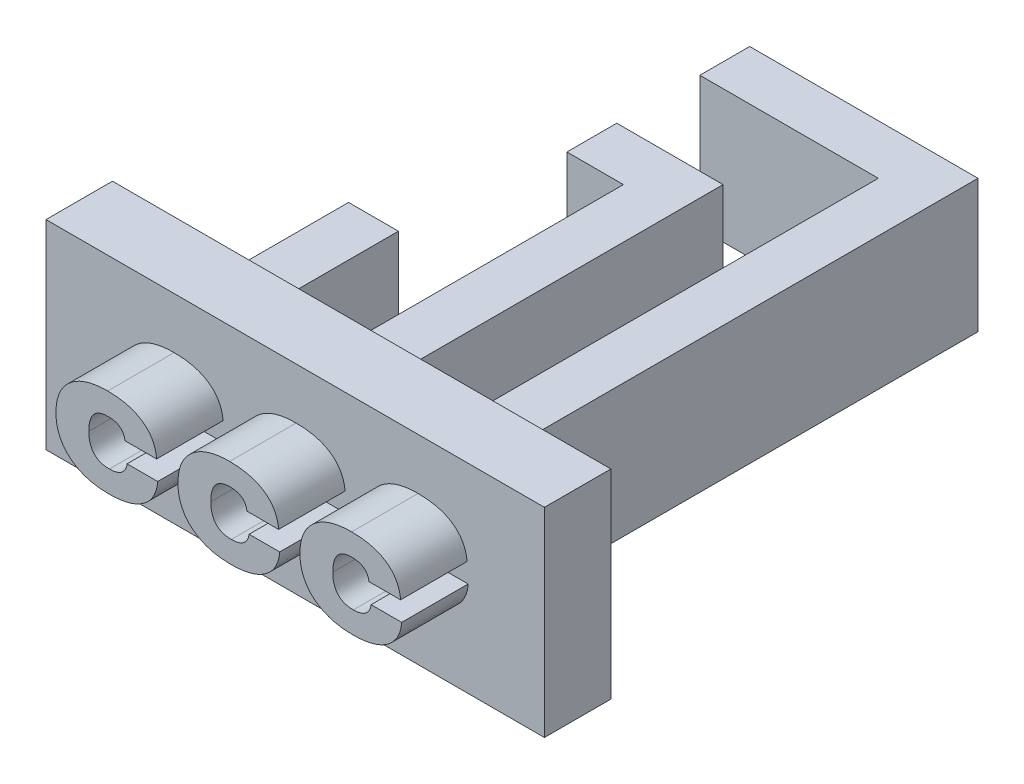
from build123d import *

# Parameters (mm, degrees)
SKETCH1_W           = 15
SKETCH1_H           = 6
BOSS_EXTRUDE1_DEPTH = 2
BOSS_EXTRUDE2_DEPTH = 2
SKETCH3_W           = 1.5
SKETCH3_H           = 4
BOSS_EXTRUDE3_DEPTH = 2


with BuildPart() as part:
    # Sketch1 → Boss-Extrude1 (new body)
    with BuildSketch(Plane.XY):
        Rectangle(SKETCH1_W, SKETCH1_H)
    extrude(amount=BOSS_EXTRUDE1_DEPTH)

    # Sketch2 → Boss-Extrude2 (add)
    with BuildSketch(Plane.XY.offset(2)):
        with BuildLine():
            Line((-3.060082731, -0.145888163), (-2.138122178, -0.145888163))
            add(Edge.make_bspline(
                [(-2.138122178, -0.145888163), (-2.142670856, -0.186817863), (-2.151591905, -0.267090827), (-2.177769169, -0.383345409), (-2.21581097, -0.492138159), (-2.263624462, -0.594453887), (-2.323094811, -0.689286262), (-2.393268208, -0.777226894), (-2.474496925, -0.857513187), (-2.56593251, -0.930702134), (-2.666921735, -0.996049335), (-2.776982197, -1.052595512), (-2.895454873, -1.100578301), (-3.022533127, -1.139544776), (-3.158112272, -1.169766838), (-3.302219404, -1.190920315), (-3.454592079, -1.204838445), (-3.559102892, -1.206109201), (-3.612641679, -1.206760184)],
                knots=[0, 0, 0, 0, 0.976829506, 1.915797078, 2.820653329, 3.707285315, 4.590388637, 5.470720937, 6.371504049, 7.295059075, 8.245589783, 9.221265507, 10.22720936, 11.275107911, 12.372107559, 13.52041678, 14.729759393, 16, 16, 16, 16], degree=3))
            add(Edge.make_bspline(
                [(-3.612641679, -1.206760184), (-3.672703037, -1.205681875), (-3.78980194, -1.203579545), (-3.960409691, -1.187028741), (-4.121131552, -1.159524222), (-4.272151379, -1.120467746), (-4.41338954, -1.070117311), (-4.545018014, -1.008999239), (-4.666052683, -0.9357143), (-4.759428604, -0.866298777), (-4.827861299, -0.80519677), (-4.876126049, -0.757629416), (-4.920907868, -0.707879294), (-4.961799812, -0.655502017), (-5.001017469, -0.602324328), (-5.03520084, -0.545835782), (-5.066531819, -0.487757573), (-5.095227297, -0.427867871), (-5.119706435, -0.365492075), (-5.141169611, -0.301230601), (-5.160246588, -0.235142926), (-5.173972983, -0.16652574), (-5.186283094, -0.096102513), (-5.194098935, -0.023574116), (-5.199662301, 0.050901618), (-5.200117214, 0.101226019), (-5.200348302, 0.126789902)],
                knots=[0, 0, 0, 0, 1.844349952, 3.595845402, 5.258382034, 6.847576437, 8.380255859, 9.857610627, 11.296535068, 12.718617156, 13.423703043, 14.112710587, 14.79899505, 15.477617194, 16.152961149, 16.826845299, 17.503194887, 18.179359879, 18.864977055, 19.559518563, 20.259847437, 20.975709944, 21.707382985, 22.454791923, 23.215062313, 24, 24, 24, 24], degree=3))
            add(Edge.make_bspline(
                [(-5.200348302, 0.126789902), (-5.20010237, 0.152180931), (-5.199614969, 0.202502272), (-5.194209089, 0.276824794), (-5.186092921, 0.349110093), (-5.174639319, 0.419303704), (-5.16060764, 0.487612395), (-5.142177766, 0.553751295), (-5.121526835, 0.618038985), (-5.096362936, 0.679989613), (-5.06892589, 0.74011142), (-5.037645758, 0.797974151), (-5.003916141, 0.854253903), (-4.966122932, 0.908133198), (-4.925686325, 0.960385835), (-4.880950125, 1.009688803), (-4.833769122, 1.057627908), (-4.766340776, 1.11879755), (-4.675008641, 1.189066666), (-4.555365546, 1.261581715), (-4.426723513, 1.323905616), (-4.288155058, 1.373282632), (-4.140527998, 1.412584115), (-3.983451282, 1.440688501), (-3.816730635, 1.457118665), (-3.702542629, 1.459248516), (-3.644025381, 1.460339989)],
                knots=[0, 0, 0, 0, 0.788949478, 1.563583616, 2.314590912, 3.048845008, 3.773225905, 4.480463959, 5.181590848, 5.870415235, 6.557195353, 7.234374924, 7.913502193, 8.595071886, 9.278472863, 9.965397725, 10.662604099, 11.368153272, 12.793402362, 14.235777976, 15.708930775, 17.227954371, 18.799982801, 20.451742852, 22.181645754, 24, 24, 24, 24], degree=3))
            add(Edge.make_bspline(
                [(-3.644025381, 1.460339989), (-3.590145407, 1.459654041), (-3.484967955, 1.458315025), (-3.331779518, 1.444898309), (-3.187282445, 1.425014513), (-3.051742807, 1.395613017), (-2.925065251, 1.357757509), (-2.807100237, 1.311399315), (-2.697988088, 1.256802381), (-2.597921972, 1.19407992), (-2.507288128, 1.123496152), (-2.42730916, 1.045048752), (-2.357479614, 0.959432927), (-2.298872924, 0.866301097), (-2.249803372, 0.766268305), (-2.212782576, 0.658660702), (-2.184664141, 0.544165897), (-2.175657871, 0.464783504), (-2.17104934, 0.42416334)],
                knots=[0, 0, 0, 0, 1.289638031, 2.517463008, 3.678757242, 4.779638757, 5.834372698, 6.840786757, 7.810284887, 8.751219913, 9.663723068, 10.555058948, 11.427779484, 12.302574037, 13.183982208, 14.089056298, 15.022165429, 16, 16, 16, 16], degree=3))
            Line((-2.17104934, 0.42416334), (-3.125937056, 0.42416334))
            add(Edge.make_bspline(
                [(-3.125937056, 0.42416334), (-3.127887549, 0.43930189), (-3.131710048, 0.468969842), (-3.142040136, 0.511730167), (-3.155998966, 0.551467781), (-3.173017188, 0.588472211), (-3.193630284, 0.622418347), (-3.217560825, 0.653683148), (-3.244880123, 0.682137249), (-3.275932903, 0.70732909), (-3.310313405, 0.72961548), (-3.347848304, 0.749134153), (-3.388701646, 0.76557697), (-3.432765481, 0.77899212), (-3.480105092, 0.789183756), (-3.530681368, 0.796119849), (-3.584421185, 0.801027394), (-3.621376024, 0.801535064), (-3.640423973, 0.801796736)],
                knots=[0, 0, 0, 0, 1.02792653, 2.014490992, 2.957386111, 3.862121815, 4.753924626, 5.627574869, 6.51019678, 7.405362218, 8.315615775, 9.266619089, 10.251558014, 11.278704828, 12.366648388, 13.51059177, 14.716862994, 16, 16, 16, 16], degree=3))
            add(Edge.make_bspline(
                [(-3.640423973, 0.801796736), (-3.66359615, 0.801322385), (-3.708533487, 0.800402487), (-3.773695909, 0.792761593), (-3.834173486, 0.779391176), (-3.890254475, 0.760839723), (-3.942034126, 0.737056913), (-3.989624331, 0.708404931), (-4.032399456, 0.67383737), (-4.070628025, 0.634091204), (-4.104105801, 0.588767942), (-4.133882485, 0.538692432), (-4.157647598, 0.482571167), (-4.177808251, 0.421494548), (-4.193663959, 0.355071069), (-4.204784234, 0.283334137), (-4.211575895, 0.206324597), (-4.212207123, 0.153214936), (-4.212533423, 0.125760928)],
                knots=[0, 0, 0, 0, 1.096253294, 2.125941888, 3.09853747, 4.02234602, 4.9155674, 5.789561441, 6.643741359, 7.510358195, 8.391630331, 9.304611926, 10.260406741, 11.268901007, 12.345516153, 13.487518248, 14.70122137, 16, 16, 16, 16], degree=3))
            add(Edge.make_bspline(
                [(-4.212533423, 0.125760928), (-4.212023732, 0.098820004), (-4.211034896, 0.046552836), (-4.20387538, -0.029304282), (-4.191745473, -0.100083864), (-4.174082766, -0.165772241), (-4.152269564, -0.226559049), (-4.125261299, -0.282308092), (-4.09338658, -0.333065066), (-4.056054059, -0.378504224), (-4.014296197, -0.419012114), (-3.96742428, -0.453622328), (-3.91626571, -0.483220184), (-3.860158566, -0.506780196), (-3.799647084, -0.525328362), (-3.73468148, -0.538434558), (-3.665177261, -0.547030055), (-3.617299342, -0.547812765), (-3.592576689, -0.548216932)],
                knots=[0, 0, 0, 0, 1.234472244, 2.394957414, 3.488022233, 4.52125041, 5.508253929, 6.443198368, 7.354559284, 8.248126489, 9.131859273, 10.013633023, 10.911406571, 11.833948595, 12.795981492, 13.807064445, 14.867636965, 16, 16, 16, 16], degree=3))
            add(Edge.make_bspline(
                [(-3.592576689, -0.548216932), (-3.573523043, -0.548008488), (-3.53637073, -0.547602048), (-3.482331036, -0.541902553), (-3.431051927, -0.534930223), (-3.383278569, -0.522562968), (-3.338007293, -0.508440572), (-3.295951089, -0.490511601), (-3.256998066, -0.469088819), (-3.220875063, -0.445176153), (-3.188314834, -0.417525473), (-3.158686185, -0.387396389), (-3.133666577, -0.353410241), (-3.111160748, -0.317572759), (-3.093383205, -0.278451413), (-3.078216775, -0.23709906), (-3.066824033, -0.192623437), (-3.06236613, -0.161718235), (-3.060082731, -0.145888163)],
                knots=[0, 0, 0, 0, 1.233312579, 2.404810797, 3.516940584, 4.580999436, 5.596108869, 6.586365755, 7.535726907, 8.472201243, 9.38661427, 10.29778373, 11.201885539, 12.11434029, 13.033597211, 13.978725792, 14.964675429, 16, 16, 16, 16], degree=3))
        make_face()
        with BuildLine():
            Line((0.611295902, -0.145888163), (1.533256455, -0.145888163))
            add(Edge.make_bspline(
                [(1.533256455, -0.145888163), (1.528707777, -0.186817863), (1.519786728, -0.267090827), (1.493609464, -0.383345409), (1.455567663, -0.492138159), (1.407754171, -0.594453887), (1.348283822, -0.689286262), (1.278110424, -0.777226894), (1.196881708, -0.857513187), (1.105446123, -0.930702134), (1.004456897, -0.996049335), (0.894396436, -1.052595512), (0.775923759, -1.100578301), (0.648845506, -1.139544776), (0.51326636, -1.169766838), (0.369159229, -1.190920315), (0.216786554, -1.204838445), (0.112275741, -1.206109201), (0.058736954, -1.206760184)],
                knots=[0, 0, 0, 0, 0.976829506, 1.915797078, 2.820653329, 3.707285315, 4.590388637, 5.470720937, 6.371504049, 7.295059075, 8.245589783, 9.221265507, 10.22720936, 11.275107911, 12.372107559, 13.52041678, 14.729759393, 16, 16, 16, 16], degree=3))
            add(Edge.make_bspline(
                [(0.058736954, -1.206760184), (-0.001324404, -1.205681875), (-0.118423307, -1.203579545), (-0.289031058, -1.187028741), (-0.449752919, -1.159524222), (-0.600772746, -1.120467746), (-0.742010907, -1.070117311), (-0.873639381, -1.008999239), (-0.99467405, -0.9357143), (-1.088049971, -0.866298777), (-1.156482666, -0.80519677), (-1.204747416, -0.757629416), (-1.249529235, -0.707879294), (-1.290421179, -0.655502017), (-1.329638836, -0.602324328), (-1.363822207, -0.545835782), (-1.395153186, -0.487757573), (-1.423848664, -0.427867871), (-1.448327802, -0.365492075), (-1.469790978, -0.301230601), (-1.488867955, -0.235142926), (-1.50259435, -0.16652574), (-1.514904461, -0.096102513), (-1.522720303, -0.023574116), (-1.528283668, 0.050901618), (-1.528738581, 0.101226019), (-1.528969669, 0.126789902)],
                knots=[0, 0, 0, 0, 1.844349952, 3.595845402, 5.258382034, 6.847576437, 8.380255859, 9.857610627, 11.296535068, 12.718617156, 13.423703043, 14.112710587, 14.79899505, 15.477617194, 16.152961149, 16.826845299, 17.503194887, 18.179359879, 18.864977055, 19.559518563, 20.259847437, 20.975709944, 21.707382985, 22.454791923, 23.215062313, 24, 24, 24, 24], degree=3))
            add(Edge.make_bspline(
                [(-1.528969669, 0.126789902), (-1.528723737, 0.152180931), (-1.528236336, 0.202502272), (-1.522830456, 0.276824794), (-1.514714289, 0.349110093), (-1.503260687, 0.419303704), (-1.489229007, 0.487612395), (-1.470799133, 0.553751295), (-1.450148202, 0.618038985), (-1.424984304, 0.679989613), (-1.397547257, 0.74011142), (-1.366267126, 0.797974151), (-1.332537508, 0.854253903), (-1.294744299, 0.908133198), (-1.254307692, 0.960385835), (-1.209571492, 1.009688803), (-1.162390489, 1.057627908), (-1.094962143, 1.11879755), (-1.003630008, 1.189066666), (-0.883986913, 1.261581715), (-0.75534488, 1.323905616), (-0.616776425, 1.373282632), (-0.469149365, 1.412584115), (-0.312072649, 1.440688501), (-0.145352002, 1.457118665), (-0.031163997, 1.459248516), (0.027353252, 1.460339989)],
                knots=[0, 0, 0, 0, 0.788949478, 1.563583616, 2.314590912, 3.048845008, 3.773225905, 4.480463959, 5.181590848, 5.870415235, 6.557195353, 7.234374924, 7.913502193, 8.595071886, 9.278472863, 9.965397725, 10.662604099, 11.368153272, 12.793402362, 14.235777976, 15.708930775, 17.227954371, 18.799982801, 20.451742852, 22.181645754, 24, 24, 24, 24], degree=3))
            add(Edge.make_bspline(
                [(0.027353252, 1.460339989), (0.081233226, 1.459654041), (0.186410678, 1.458315025), (0.339599115, 1.444898309), (0.484096188, 1.425014513), (0.619635826, 1.395613017), (0.746313382, 1.357757509), (0.864278396, 1.311399315), (0.973390545, 1.256802381), (1.073456661, 1.19407992), (1.164090505, 1.123496152), (1.244069473, 1.045048752), (1.313899019, 0.959432927), (1.372505709, 0.866301097), (1.421575261, 0.766268305), (1.458596057, 0.658660702), (1.486714492, 0.544165897), (1.495720762, 0.464783504), (1.500329293, 0.42416334)],
                knots=[0, 0, 0, 0, 1.289638031, 2.517463008, 3.678757242, 4.779638757, 5.834372698, 6.840786757, 7.810284887, 8.751219913, 9.663723068, 10.555058948, 11.427779484, 12.302574037, 13.183982208, 14.089056298, 15.022165429, 16, 16, 16, 16], degree=3))
            Line((1.500329293, 0.42416334), (0.545441576, 0.42416334))
            add(Edge.make_bspline(
                [(0.545441576, 0.42416334), (0.543491084, 0.43930189), (0.539668585, 0.468969842), (0.529338497, 0.511730167), (0.515379666, 0.551467781), (0.498361445, 0.588472211), (0.477748349, 0.622418347), (0.453817808, 0.653683148), (0.42649851, 0.682137249), (0.39544573, 0.70732909), (0.361065228, 0.72961548), (0.323530328, 0.749134153), (0.282676987, 0.76557697), (0.238613151, 0.77899212), (0.191273541, 0.789183756), (0.140697265, 0.796119849), (0.086957447, 0.801027394), (0.050002609, 0.801535064), (0.03095466, 0.801796736)],
                knots=[0, 0, 0, 0, 1.02792653, 2.014490992, 2.957386111, 3.862121815, 4.753924626, 5.627574869, 6.51019678, 7.405362218, 8.315615775, 9.266619089, 10.251558014, 11.278704828, 12.366648388, 13.51059177, 14.716862994, 16, 16, 16, 16], degree=3))
            add(Edge.make_bspline(
                [(0.03095466, 0.801796736), (0.007782483, 0.801322385), (-0.037154854, 0.800402487), (-0.102317276, 0.792761593), (-0.162794853, 0.779391176), (-0.218875842, 0.760839723), (-0.270655493, 0.737056913), (-0.318245698, 0.708404931), (-0.361020823, 0.67383737), (-0.399249392, 0.634091204), (-0.432727168, 0.588767942), (-0.462503853, 0.538692432), (-0.486268965, 0.482571167), (-0.506429618, 0.421494548), (-0.522285326, 0.355071069), (-0.533405601, 0.283334137), (-0.540197262, 0.206324597), (-0.54082849, 0.153214936), (-0.54115479, 0.125760928)],
                knots=[0, 0, 0, 0, 1.096253294, 2.125941888, 3.09853747, 4.02234602, 4.9155674, 5.789561441, 6.643741359, 7.510358195, 8.391630331, 9.304611926, 10.260406741, 11.268901007, 12.345516153, 13.487518248, 14.70122137, 16, 16, 16, 16], degree=3))
            add(Edge.make_bspline(
                [(-0.54115479, 0.125760928), (-0.540645099, 0.098820004), (-0.539656263, 0.046552836), (-0.532496747, -0.029304282), (-0.52036684, -0.100083864), (-0.502704133, -0.165772241), (-0.480890931, -0.226559049), (-0.453882667, -0.282308092), (-0.422007947, -0.333065066), (-0.384675426, -0.378504224), (-0.342917564, -0.419012114), (-0.296045647, -0.453622328), (-0.244887077, -0.483220184), (-0.188779933, -0.506780196), (-0.128268451, -0.525328362), (-0.063302847, -0.538434558), (0.006201372, -0.547030055), (0.054079291, -0.547812765), (0.078801944, -0.548216932)],
                knots=[0, 0, 0, 0, 1.234472244, 2.394957414, 3.488022233, 4.52125041, 5.508253929, 6.443198368, 7.354559284, 8.248126489, 9.131859273, 10.013633023, 10.911406571, 11.833948595, 12.795981492, 13.807064445, 14.867636965, 16, 16, 16, 16], degree=3))
            add(Edge.make_bspline(
                [(0.078801944, -0.548216932), (0.09785559, -0.548008488), (0.135007902, -0.547602048), (0.189047596, -0.541902553), (0.240326706, -0.534930223), (0.288100063, -0.522562968), (0.33337134, -0.508440572), (0.375427544, -0.490511601), (0.414380567, -0.469088819), (0.45050357, -0.445176153), (0.483063798, -0.417525473), (0.512692448, -0.387396389), (0.537712056, -0.353410241), (0.560217885, -0.317572759), (0.577995428, -0.278451413), (0.593161858, -0.23709906), (0.6045546, -0.192623437), (0.609012502, -0.161718235), (0.611295902, -0.145888163)],
                knots=[0, 0, 0, 0, 1.233312579, 2.404810797, 3.516940584, 4.580999436, 5.596108869, 6.586365755, 7.535726907, 8.472201243, 9.38661427, 10.29778373, 11.201885539, 12.11434029, 13.033597211, 13.978725792, 14.964675429, 16, 16, 16, 16], degree=3))
        make_face()
        with BuildLine():
            Line((4.282674535, -0.145888163), (5.204635088, -0.145888163))
            add(Edge.make_bspline(
                [(5.204635088, -0.145888163), (5.20008641, -0.186817863), (5.191165361, -0.267090827), (5.164988097, -0.383345409), (5.126946296, -0.492138159), (5.079132804, -0.594453887), (5.019662455, -0.689286262), (4.949489057, -0.777226894), (4.868260341, -0.857513187), (4.776824756, -0.930702134), (4.67583553, -0.996049335), (4.565775069, -1.052595512), (4.447302392, -1.100578301), (4.320224139, -1.139544776), (4.184644993, -1.169766838), (4.040537862, -1.190920315), (3.888165187, -1.204838445), (3.783654374, -1.206109201), (3.730115587, -1.206760184)],
                knots=[0, 0, 0, 0, 0.976829506, 1.915797078, 2.820653329, 3.707285315, 4.590388637, 5.470720937, 6.371504049, 7.295059075, 8.245589783, 9.221265507, 10.22720936, 11.275107911, 12.372107559, 13.52041678, 14.729759393, 16, 16, 16, 16], degree=3))
            add(Edge.make_bspline(
                [(3.730115587, -1.206760184), (3.670054229, -1.205681875), (3.552955326, -1.203579545), (3.382347575, -1.187028741), (3.221625714, -1.159524222), (3.070605887, -1.120467746), (2.929367726, -1.070117311), (2.797739252, -1.008999239), (2.676704583, -0.9357143), (2.583328662, -0.866298777), (2.514895967, -0.80519677), (2.466631217, -0.757629416), (2.421849398, -0.707879294), (2.380957454, -0.655502017), (2.341739797, -0.602324328), (2.307556425, -0.545835782), (2.276225447, -0.487757573), (2.247529968, -0.427867871), (2.223050831, -0.365492075), (2.201587655, -0.301230601), (2.182510678, -0.235142926), (2.168784283, -0.16652574), (2.156474172, -0.096102513), (2.14865833, -0.023574116), (2.143094965, 0.050901618), (2.142640052, 0.101226019), (2.142408964, 0.126789902)],
                knots=[0, 0, 0, 0, 1.844349952, 3.595845402, 5.258382034, 6.847576437, 8.380255859, 9.857610627, 11.296535068, 12.718617156, 13.423703043, 14.112710587, 14.79899505, 15.477617194, 16.152961149, 16.826845299, 17.503194887, 18.179359879, 18.864977055, 19.559518563, 20.259847437, 20.975709944, 21.707382985, 22.454791923, 23.215062313, 24, 24, 24, 24], degree=3))
            add(Edge.make_bspline(
                [(2.142408964, 0.126789902), (2.142654896, 0.152180931), (2.143142297, 0.202502272), (2.148548177, 0.276824794), (2.156664344, 0.349110093), (2.168117946, 0.419303704), (2.182149625, 0.487612395), (2.2005795, 0.553751295), (2.221230431, 0.618038985), (2.246394329, 0.679989613), (2.273831375, 0.74011142), (2.305111507, 0.797974151), (2.338841125, 0.854253903), (2.376634334, 0.908133198), (2.417070941, 0.960385835), (2.461807141, 1.009688803), (2.508988144, 1.057627908), (2.57641649, 1.11879755), (2.667748625, 1.189066666), (2.78739172, 1.261581715), (2.916033753, 1.323905616), (3.054602208, 1.373282632), (3.202229268, 1.412584115), (3.359305984, 1.440688501), (3.52602663, 1.457118665), (3.640214636, 1.459248516), (3.698731885, 1.460339989)],
                knots=[0, 0, 0, 0, 0.788949478, 1.563583616, 2.314590912, 3.048845008, 3.773225905, 4.480463959, 5.181590848, 5.870415235, 6.557195353, 7.234374924, 7.913502193, 8.595071886, 9.278472863, 9.965397725, 10.662604099, 11.368153272, 12.793402362, 14.235777976, 15.708930775, 17.227954371, 18.799982801, 20.451742852, 22.181645754, 24, 24, 24, 24], degree=3))
            add(Edge.make_bspline(
                [(3.698731885, 1.460339989), (3.752611859, 1.459654041), (3.857789311, 1.458315025), (4.010977748, 1.444898309), (4.155474821, 1.425014513), (4.291014459, 1.395613017), (4.417692015, 1.357757509), (4.535657029, 1.311399315), (4.644769178, 1.256802381), (4.744835294, 1.19407992), (4.835469138, 1.123496152), (4.915448106, 1.045048752), (4.985277651, 0.959432927), (5.043884342, 0.866301097), (5.092953894, 0.766268305), (5.12997469, 0.658660702), (5.158093125, 0.544165897), (5.167099395, 0.464783504), (5.171707925, 0.42416334)],
                knots=[0, 0, 0, 0, 1.289638031, 2.517463008, 3.678757242, 4.779638757, 5.834372698, 6.840786757, 7.810284887, 8.751219913, 9.663723068, 10.555058948, 11.427779484, 12.302574037, 13.183982208, 14.089056298, 15.022165429, 16, 16, 16, 16], degree=3))
            Line((5.171707925, 0.42416334), (4.216820209, 0.42416334))
            add(Edge.make_bspline(
                [(4.216820209, 0.42416334), (4.214869717, 0.43930189), (4.211047218, 0.468969842), (4.20071713, 0.511730167), (4.186758299, 0.551467781), (4.169740078, 0.588472211), (4.149126982, 0.622418347), (4.125196441, 0.653683148), (4.097877142, 0.682137249), (4.066824363, 0.70732909), (4.032443861, 0.72961548), (3.994908961, 0.749134153), (3.95405562, 0.76557697), (3.909991784, 0.77899212), (3.862652174, 0.789183756), (3.812075898, 0.796119849), (3.75833608, 0.801027394), (3.721381242, 0.801535064), (3.702333293, 0.801796736)],
                knots=[0, 0, 0, 0, 1.02792653, 2.014490992, 2.957386111, 3.862121815, 4.753924626, 5.627574869, 6.51019678, 7.405362218, 8.315615775, 9.266619089, 10.251558014, 11.278704828, 12.366648388, 13.51059177, 14.716862994, 16, 16, 16, 16], degree=3))
            add(Edge.make_bspline(
                [(3.702333293, 0.801796736), (3.679161115, 0.801322385), (3.634223779, 0.800402487), (3.569061357, 0.792761593), (3.50858378, 0.779391176), (3.452502791, 0.760839723), (3.400723139, 0.737056913), (3.353132935, 0.708404931), (3.31035781, 0.67383737), (3.272129241, 0.634091204), (3.238651465, 0.588767942), (3.20887478, 0.538692432), (3.185109668, 0.482571167), (3.164949015, 0.421494548), (3.149093307, 0.355071069), (3.137973032, 0.283334137), (3.13118137, 0.206324597), (3.130550143, 0.153214936), (3.130223843, 0.125760928)],
                knots=[0, 0, 0, 0, 1.096253294, 2.125941888, 3.09853747, 4.02234602, 4.9155674, 5.789561441, 6.643741359, 7.510358195, 8.391630331, 9.304611926, 10.260406741, 11.268901007, 12.345516153, 13.487518248, 14.70122137, 16, 16, 16, 16], degree=3))
            add(Edge.make_bspline(
                [(3.130223843, 0.125760928), (3.130733534, 0.098820004), (3.131722369, 0.046552836), (3.138881885, -0.029304282), (3.151011793, -0.100083864), (3.1686745, -0.165772241), (3.190487702, -0.226559049), (3.217495966, -0.282308092), (3.249370686, -0.333065066), (3.286703207, -0.378504224), (3.328461069, -0.419012114), (3.375332985, -0.453622328), (3.426491556, -0.483220184), (3.4825987, -0.506780196), (3.543110182, -0.525328362), (3.608075786, -0.538434558), (3.677580005, -0.547030055), (3.725457923, -0.547812765), (3.750180576, -0.548216932)],
                knots=[0, 0, 0, 0, 1.234472244, 2.394957414, 3.488022233, 4.52125041, 5.508253929, 6.443198368, 7.354559284, 8.248126489, 9.131859273, 10.013633023, 10.911406571, 11.833948595, 12.795981492, 13.807064445, 14.867636965, 16, 16, 16, 16], degree=3))
            add(Edge.make_bspline(
                [(3.750180576, -0.548216932), (3.769234223, -0.548008488), (3.806386535, -0.547602048), (3.860426229, -0.541902553), (3.911705338, -0.534930223), (3.959478696, -0.522562968), (4.004749973, -0.508440572), (4.046806177, -0.490511601), (4.0857592, -0.469088819), (4.121882203, -0.445176153), (4.154442431, -0.417525473), (4.184071081, -0.387396389), (4.209090689, -0.353410241), (4.231596518, -0.317572759), (4.249374061, -0.278451413), (4.264540491, -0.23709906), (4.275933233, -0.192623437), (4.280391135, -0.161718235), (4.282674535, -0.145888163)],
                knots=[0, 0, 0, 0, 1.233312579, 2.404810797, 3.516940584, 4.580999436, 5.596108869, 6.586365755, 7.535726907, 8.472201243, 9.38661427, 10.29778373, 11.201885539, 12.11434029, 13.033597211, 13.978725792, 14.964675429, 16, 16, 16, 16], degree=3))
        make_face()
    extrude(amount=BOSS_EXTRUDE2_DEPTH)

    # Sketch3 → Boss-Extrude3 (add, symmetric)
    with BuildSketch(Plane(origin=(0, 0, 0), x_dir=(1, 0, 0), z_dir=(0, 1, 0))):
        Polygon((2.948731885, 0), (4.448731885, 0), (4.448731885, 14.1), (-2.422646748, 14.1), (-2.422646748, 12.6), (2.948731885, 12.6), align=None)
        with Locations((-3.644025381, 2)):
            Rectangle(SKETCH3_W, SKETCH3_H)
        Polygon((-0.722646748, 0), (0.777353252, 0), (0.777353252, 10.1), (-2.422646748, 10.1), (-2.422646748, 8.6), (-0.722646748, 8.6), align=None)
    extrude(amount=BOSS_EXTRUDE3_DEPTH, both=True)


solid = part.part
